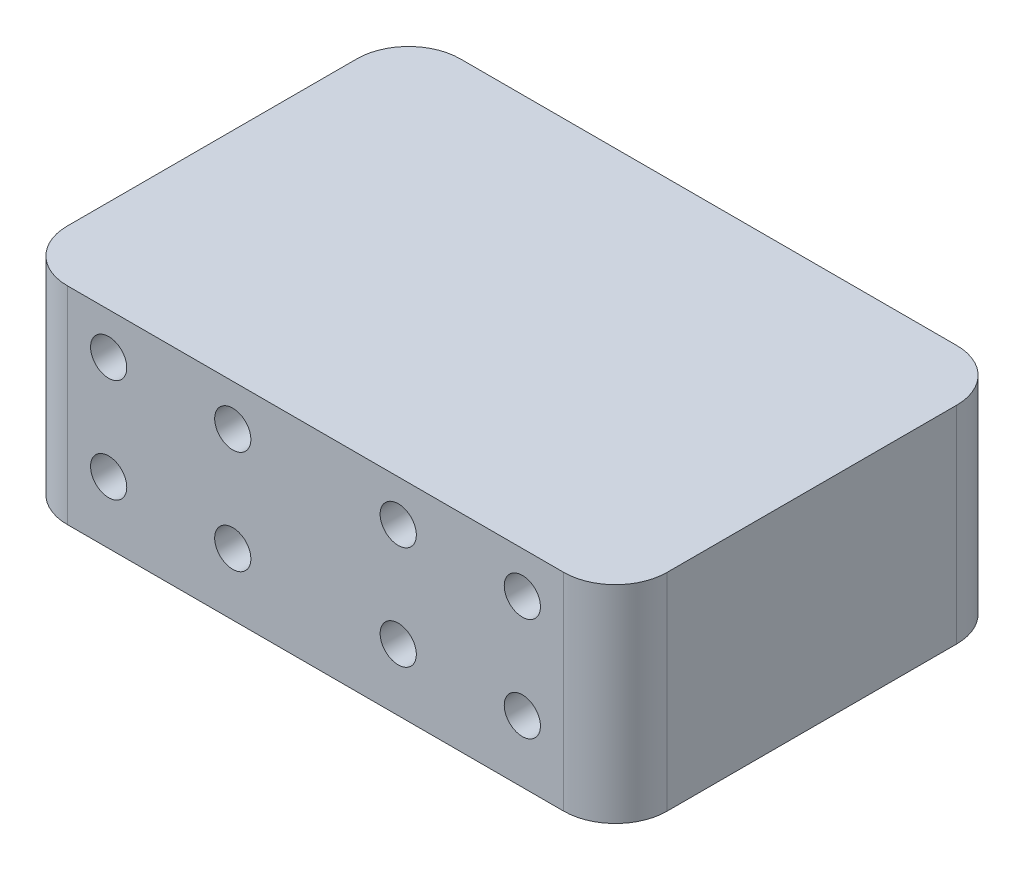
from build123d import *

# Parameters (mm, degrees)
SKETCH_1_W      = 58
SKETCH_1_H      = 20
SKETCH_1_R      = 1.75
EXTRUDE_1_DEPTH = 38
FILLET_1_R      = 5


with BuildPart() as part:
    # 草图1 → 凸台-拉伸1 (new body)
    with BuildSketch(Plane.XY):
        Rectangle(SKETCH_1_W, SKETCH_1_H)
        with Locations((-20, 6)):
            Circle(SKETCH_1_R, mode=Mode.SUBTRACT)
        with Locations((-8, 6)):
            Circle(SKETCH_1_R, mode=Mode.SUBTRACT)
        with Locations(Location((8, 6, 0), (0, 0, 180))):
            Circle(SKETCH_1_R, mode=Mode.SUBTRACT)
        with Locations(Location((20, 6, 0), (0, 0, 180))):
            Circle(SKETCH_1_R, mode=Mode.SUBTRACT)
        with Locations((-20, -4)):
            Circle(SKETCH_1_R, mode=Mode.SUBTRACT)
        with Locations((-8, -4)):
            Circle(SKETCH_1_R, mode=Mode.SUBTRACT)
        with Locations(Location((8, -4, 0), (0, 0, 180))):
            Circle(SKETCH_1_R, mode=Mode.SUBTRACT)
        with Locations(Location((20, -4, 0), (0, 0, 180))):
            Circle(SKETCH_1_R, mode=Mode.SUBTRACT)
    extrude(amount=EXTRUDE_1_DEPTH)

    # 圆角1
    fillet_1_edges = [part.edges().sort_by_distance(p)[0] for p in [
        (-29, 0, 38),
        (29, 0, 38),
        (-29, 0, 0),
        (29, 0, 0),
    ]]
    fillet(fillet_1_edges, radius=FILLET_1_R)


solid = part.part
